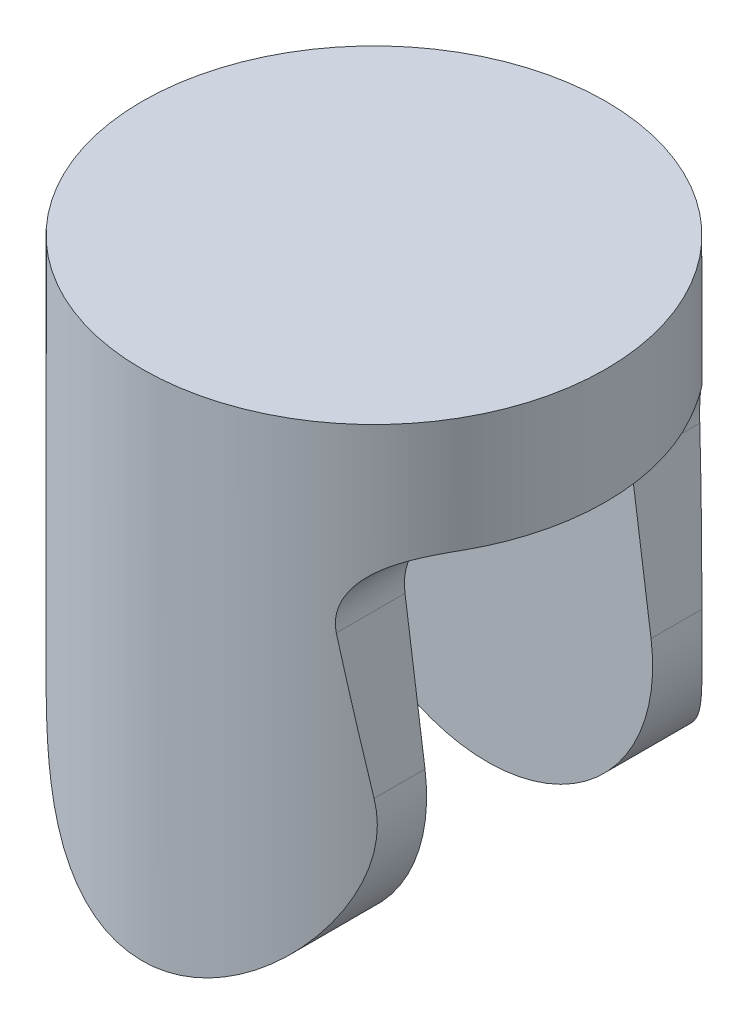
from build123d import *

# Parameters (mm, degrees)
SKETCH1_R                = 119
BOSS_EXTRUDE1_DEPTH      = 59
BOSS_EXTRUDE2_REACH      = 223.294
BOSS_EXTRUDE2_END_RADIUS = 119
FILLET1_R                = 30
FILLET2_R                = 10
FILLET1_OF_MIRROR1_R     = 30
FILLET2_OF_MIRROR1_R     = 10
BODY_MOVE_COPY2_ANGLE    = 180


with BuildPart() as part:
    # Sketch1 → Boss-Extrude1 (new body)
    with BuildSketch(Plane(origin=(0, 0, 0), x_dir=(1, 0, 0), z_dir=(0, 1, 0))):
        with Locations(Location((0, 0, 0), (0, 0, 90))):
            Circle(SKETCH1_R)
    extrude(amount=BOSS_EXTRUDE1_DEPTH)

    # Boss-Extrude2: up to this cylinder (the profile starts inside it)
    boss_extrude2_end = Plane(origin=(0, 153.577845, 0), z_dir=(0, -1, 0)) * Cylinder(BOSS_EXTRUDE2_END_RADIUS, 685.588, mode=Mode.PRIVATE)
    # Sketch2 → Boss-Extrude2 (add, up to the surface)
    with BuildSketch(Plane(origin=(58, 0, 0), x_dir=(0, 0, -1), z_dir=(1, 0, 0)), mode=Mode.PRIVATE) as boss_extrude2_sk1:
        with BuildLine():
            Line((-69.110984334, 59), (-84.172785843, 166.170286418))
            ThreePointArc((-84.172785843, 166.170286418), (-8.884919378, 262.534361106), (84.792944272, 183.929300268))
            Line((84.792944272, 183.929300268), (93.528851958, 59))
            Line((93.528851958, 59), (-69.110984334, 59))
        make_face()
    boss_extrude2_tool1 = extrude(boss_extrude2_sk1.sketch, amount=BOSS_EXTRUDE2_REACH, mode=Mode.PRIVATE) & boss_extrude2_end
    boss_extrude2 = boss_extrude2_tool1.solids().sort_by_distance((58, 153.577845, -3.761368))[0]
    add(boss_extrude2)

    # Fillet1
    fillet1_edges = [part.edges().sort_by_distance(p)[0] for p in [
        (77.437257985, 59, 69.110984334),
    ]]
    fillet(fillet1_edges, radius=FILLET1_R)

    # Fillet2
    fillet2_edges = [part.edges().sort_by_distance(p)[0] for p in [
        (65.787748815, 59, -93.528851958),
    ]]
    fillet(fillet2_edges, radius=FILLET2_R)

    # Mirror1: Boss-Extrude2 across plane
    add(boss_extrude2.mirror(Plane(origin=(0, 0, 0), x_dir=(0, 0, 1), z_dir=(1, 0, 0))))

    # Fillet1 of Mirror1
    fillet1_of_mirror1_edges = [part.edges().sort_by_distance(p)[0] for p in [
        (-77.437257985, 59, 69.110984334),
    ]]
    fillet(fillet1_of_mirror1_edges, radius=FILLET1_OF_MIRROR1_R)

    # Fillet2 of Mirror1
    fillet2_of_mirror1_edges = [part.edges().sort_by_distance(p)[0] for p in [
        (-65.787748815, 59, -93.528851958),
    ]]
    fillet(fillet2_of_mirror1_edges, radius=FILLET2_OF_MIRROR1_R)


with BuildPart() as part_1:
    # Body-Move/Copy1: moved
    add(part.part.moved(Location((0, -178, 0))))


with BuildPart() as part_2:
    # Body-Move/Copy2: moved
    add(part_1.part.rotate(Axis((0, 0, 0), (0.7071067811865462, 0, 0.7071067811865488)), BODY_MOVE_COPY2_ANGLE))


solid = part_2.part
